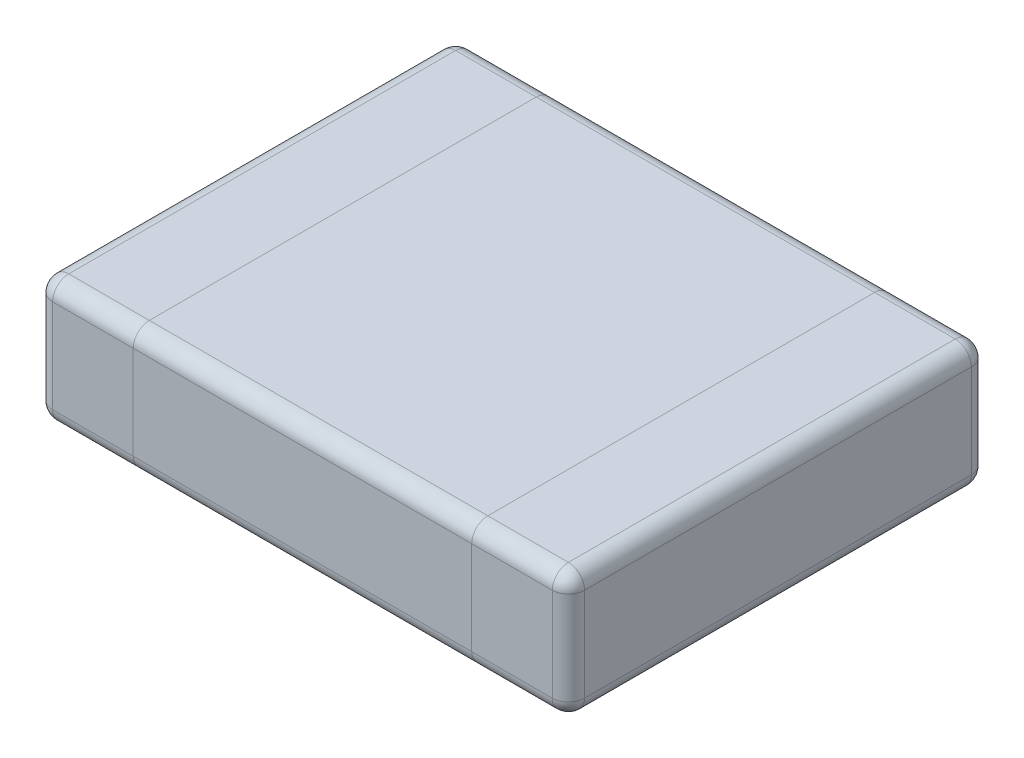
from build123d import *

# Parameters (mm, degrees)
CROQUIS1_W                = 2.1
CROQUIS1_H                = 2.6
SALIENTE_EXTRUIR1_DEPTH   = 0.78
CROQUIS3_W                = 0.6
CROQUIS3_H                = 2.6
SALIENTE_EXTRUIR3_DEPTH   = 0.78
SALIENTE_EXTRUIR3_2_DEPTH = 0.78
REDONDEO2_R               = 0.1
REDONDEO4_R               = 0.1
REDONDEO5_R               = 0.1


with BuildPart() as part:
    # Croquis1 → Saliente-Extruir1 (new body)
    with BuildSketch(Plane(origin=(0, 0, 0), x_dir=(1, 0, 0), z_dir=(0, 1, 0))):
        Rectangle(CROQUIS1_W, CROQUIS1_H)
    extrude(amount=SALIENTE_EXTRUIR1_DEPTH)

    # Redondeo2
    redondeo2_edges = [part.edges().sort_by_distance(p)[0] for p in [
        (0, 0.78, 1.3),
        (0, 0, 1.3),
        (0, 0, -1.3),
        (0, 0.78, -1.3),
    ]]
    fillet(redondeo2_edges, radius=REDONDEO2_R)


with BuildPart() as body_2:
    # Croquis3 → Saliente-Extruir3 (new body)
    with BuildSketch(Plane(origin=(0, 0, 0), x_dir=(1, 0, 0), z_dir=(0, 1, 0))):
        with Locations((1.35, 0)):
            Rectangle(CROQUIS3_W, CROQUIS3_H)
    extrude(amount=SALIENTE_EXTRUIR3_DEPTH)

    # Redondeo4
    redondeo4_edges = [body_2.edges().sort_by_distance(p)[0] for p in [
        (1.65, 0.78, 0),
        (1.35, 0.78, -1.3),
        (1.35, 0, -1.3),
        (1.65, 0, 0),
        (1.35, 0, 1.3),
        (1.65, 0.39, -1.3),
        (1.65, 0.39, 1.3),
        (1.35, 0.78, 1.3),
    ]]
    fillet(redondeo4_edges, radius=REDONDEO4_R)


with BuildPart() as body_3:
    # Croquis3 → Saliente-Extruir3 2 (new body)
    with BuildSketch(Plane(origin=(0, 0, 0), x_dir=(1, 0, 0), z_dir=(0, 1, 0))):
        with Locations((-1.35, 0)):
            Rectangle(CROQUIS3_W, CROQUIS3_H)
    extrude(amount=SALIENTE_EXTRUIR3_2_DEPTH)

    # Redondeo5
    redondeo5_edges = [body_3.edges().sort_by_distance(p)[0] for p in [
        (-1.35, 0.78, -1.3),
        (-1.65, 0.78, 0),
        (-1.35, 0.78, 1.3),
        (-1.65, 0, 0),
        (-1.35, 0, -1.3),
        (-1.35, 0, 1.3),
        (-1.65, 0.39, 1.3),
        (-1.65, 0.39, -1.3),
    ]]
    fillet(redondeo5_edges, radius=REDONDEO5_R)


solid = Compound([part.part, body_2.part, body_3.part])
